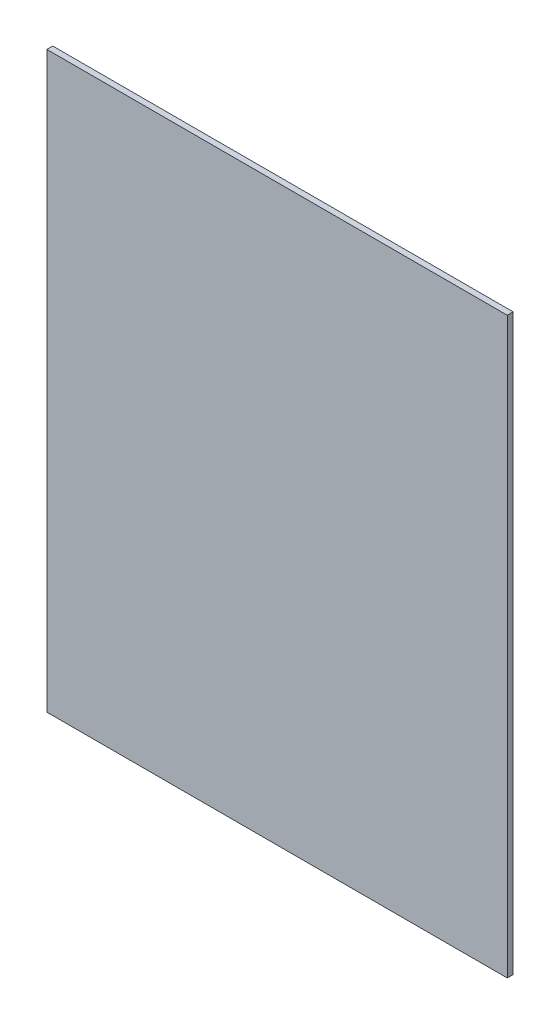
from build123d import *

# Parameters (mm, degrees)
SKETCH1_W           = 234.315
SKETCH1_H           = 292.1
BOSS_EXTRUDE1_DEPTH = 2.9972


with BuildPart() as part:
    # Sketch1 → Boss-Extrude1 (new body)
    with BuildSketch(Plane.XY):
        Rectangle(SKETCH1_W, SKETCH1_H)
    extrude(amount=BOSS_EXTRUDE1_DEPTH)


solid = part.part
